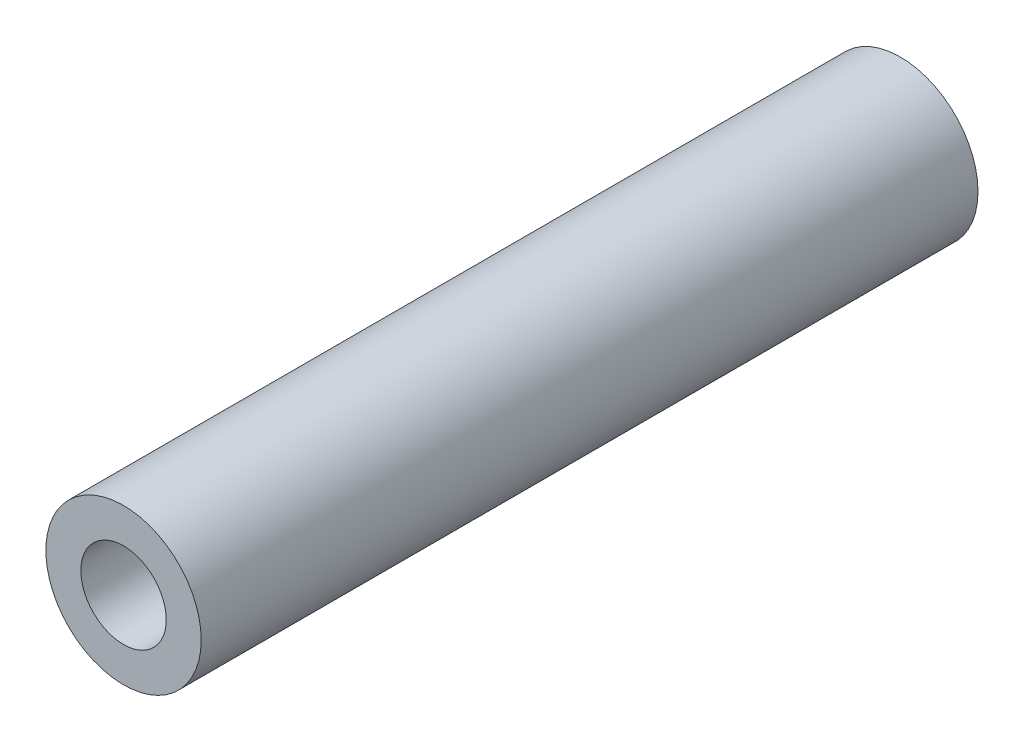
from build123d import *

# Parameters (mm, degrees)
SKETCH1_R           = 3
SKETCH1_R_2         = 1.65
BOSS_EXTRUDE1_DEPTH = 15


with BuildPart() as part:
    # Sketch1 → Boss-Extrude1 (new, symmetric)
    with BuildSketch(Plane.XY):
        Circle(SKETCH1_R)
        Circle(SKETCH1_R_2, mode=Mode.SUBTRACT)
    extrude(amount=BOSS_EXTRUDE1_DEPTH, both=True)


solid = part.part
